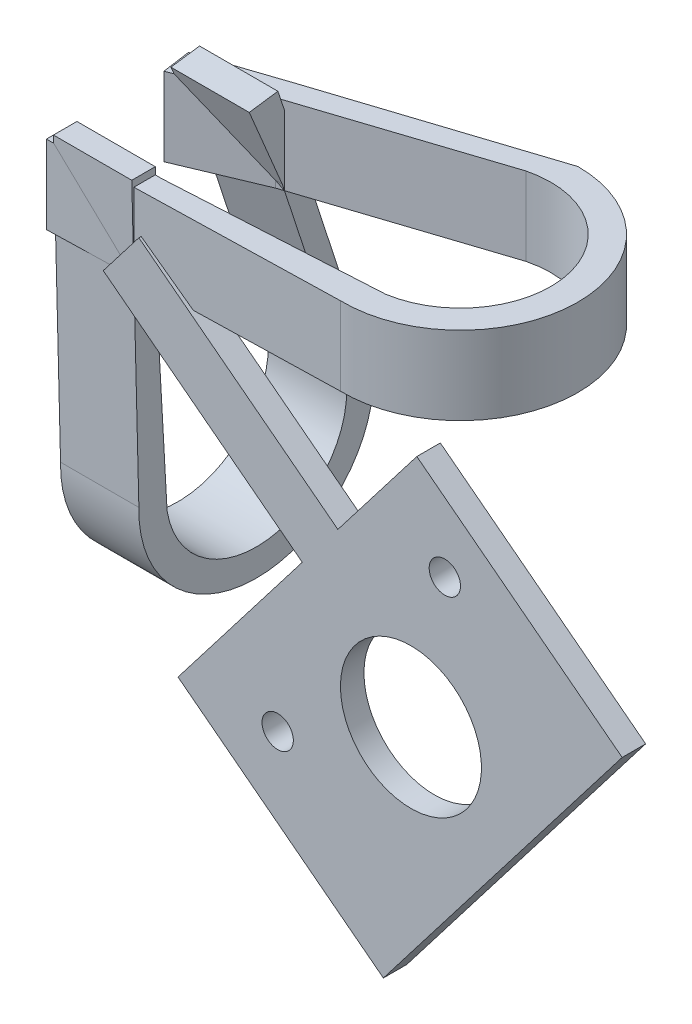
from build123d import *

# Parameters (mm, degrees)
BOSS_EXTRUDE1_DEPTH = 10
CIRPATTERN1_COUNT   = 2
CIRPATTERN1_ANGLE   = 90
SKETCH4_R           = 2
SKETCH4_R_2         = 9
BOSS_EXTRUDE2_DEPTH = 3


with BuildPart() as part:
    # Sketch1 → Boss-Extrude1 (new body)
    with BuildSketch(Plane(origin=(0, 0, 0), x_dir=(1, 0, 0), z_dir=(0, 1, 0))):
        with BuildLine():
            Line((0, 15), (-26.900155428, 6.278700475))
            Line((-26.900155428, 6.278700475), (-37.47437809, 2.750369919))
            Line((-37.47437809, 2.750369919), (-36.958650594, -0.903972442))
            Line((-36.958650594, -0.903972442), (-26.900155428, 3.317423045))
            Line((-26.900155428, 3.317423045), (-2.821131559, 11.193160892))
            ThreePointArc((-2.821131559, 11.193160892), (11.303828334, 2.338610491), (1.8517881, -11.393705054))
            Line((1.8517881, -11.393705054), (-25.145499842, -12.903972442))
            Line((-25.145499842, -12.903972442), (-32.586903668, -12.903972442))
            Line((-32.586903668, -12.903972442), (-36.958650594, -12.903972442))
            Line((-36.958650594, -12.903972442), (-36.958650594, -15.903972442))
            Line((-36.958650594, -15.903972442), (-0.325723138, -14.996463064))
            ThreePointArc((-0.325723138, -14.996463064), (14.99911574, -0.16287117), (0, 15))
        make_face()
    boss_extrude1 = extrude(amount=BOSS_EXTRUDE1_DEPTH)

    # CirPattern1: Boss-Extrude1 ×2 about axis
    cirpattern1_axis = Axis((-31.052075218, 5, 0), (0, 0, -1))
    for i in range(1, CIRPATTERN1_COUNT):
        add(boss_extrude1.rotate(cirpattern1_axis, i * CIRPATTERN1_ANGLE / (CIRPATTERN1_COUNT - 1)))

    # Sketch4 → Boss-Extrude2 (add)
    with BuildSketch(Plane(origin=(0, 0, 12.903972442), x_dir=(-1, 0, 0), z_dir=(0, 0, -1))):
        Polygon((25.145499842, 5), (29.689369088, -0.906575376), (4.282629912, -20.451725217), (20.145121552, -41.071377206), (-6.070129591, -61.238507201), (-36.557141793, -21.608441758), (-10.34189065, -1.441311764), (-0.261239334, -14.545149841), align=None)
        with Locations((-13.91810605, -12.988615209)):
            Circle(SKETCH4_R, mode=Mode.SUBTRACT)
        with Locations((7.422802492, -40.729661018)):
            Circle(SKETCH4_R, mode=Mode.SUBTRACT)
        with Locations((-9.58846225, -31.737060066)):
            Circle(SKETCH4_R_2, mode=Mode.SUBTRACT)
    extrude(amount=-BOSS_EXTRUDE2_DEPTH)


solid = part.part
